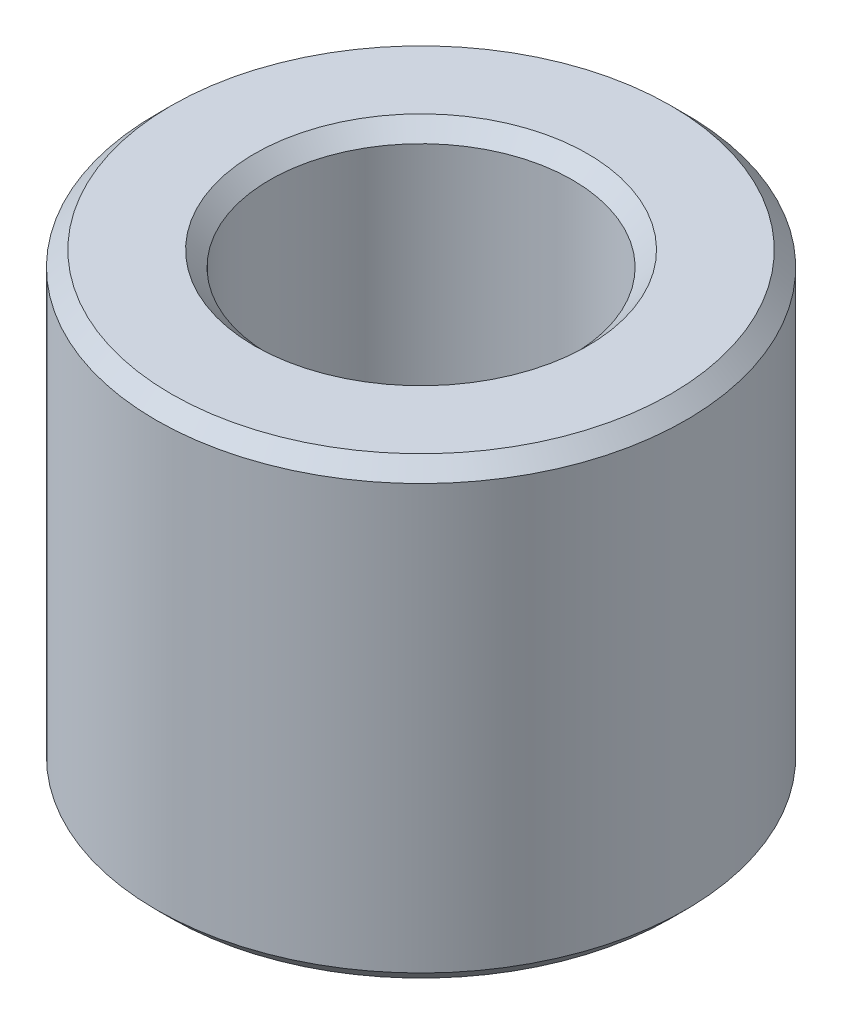
from build123d import *

# Parameters (mm, degrees)
SZKIC1_R                    = 3.5
SZKIC1_R_2                  = 2
DODANIE_WYCI_GNI_CIE1_DEPTH = 6
SFAZOWANIE1_SIZE            = 0.2


with BuildPart() as part:
    # Szkic1 → Dodanie-wyciągnięcie1 (new body)
    with BuildSketch(Plane(origin=(0, 0, 0), x_dir=(1, 0, 0), z_dir=(0, 1, 0))):
        with Locations(Location((0, 0, 0), (0, 0, 270))):
            Circle(SZKIC1_R)
        with Locations(Location((0, 0, 0), (0, 0, 270))):
            Circle(SZKIC1_R_2, mode=Mode.SUBTRACT)
    extrude(amount=DODANIE_WYCI_GNI_CIE1_DEPTH)

    # Sfazowanie1
    sfazowanie1_edges = [part.edges().sort_by_distance(p)[0] for p in [
        (0, 0, -3.5),
        (0, 6, -3.5),
        (0, 0, -2),
        (0, 6, -2),
    ]]
    chamfer(sfazowanie1_edges, length=SFAZOWANIE1_SIZE)


solid = part.part
